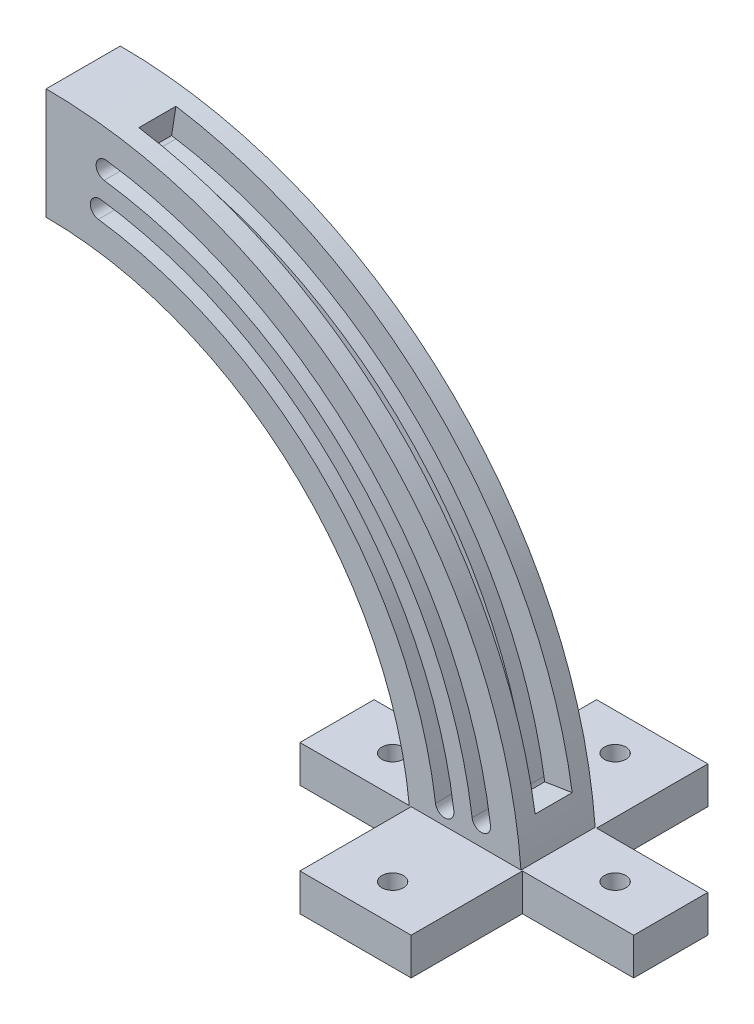
from build123d import *

# Parameters (mm, degrees)
BOSS_EXTRUDE1_DEPTH = 12.7
CUT_EXTRUDE1_DEPTH  = 6.35
CUT_EXTRUDE2_DEPTH  = 233.052537155
SKETCH5_R           = 3.675
BOSS_EXTRUDE2_DEPTH = 12.7


with BuildPart() as part:
    # Sketch1 → Boss-Extrude1 (new, symmetric)
    with BuildSketch(Plane.XY):
        with BuildLine():
            Line((0, 163.1), (0, 125))
            ThreePointArc((0, 125), (88.388347648, 88.388347648), (125, 0))
            Line((125, 0), (163.1, 0))
            ThreePointArc((163.1, 0), (115.329116012, 115.329116012), (0, 163.1))
        make_face()
    extrude(amount=BOSS_EXTRUDE1_DEPTH, both=True)

    # Sketch3 → Cut-Extrude1 (cut, symmetric)
    with BuildSketch(Plane.XY):
        with BuildLine():
            Line((25.4, 161.110055552), (19.466584917, 123.474904623))
            ThreePointArc((19.466584917, 123.474904623), (88.388347648, 88.388347648), (123.474904623, 19.466584917))
            Line((123.474904623, 19.466584917), (161.110055552, 25.4))
            ThreePointArc((161.110055552, 25.4), (115.329116012, 115.329116012), (25.4, 161.110055552))
        make_face()
    extrude(amount=CUT_EXTRUDE1_DEPTH, both=True, mode=Mode.SUBTRACT)

    # Sketch4 → Cut-Extrude2 (cut, through all)
    with BuildSketch(Plane.XY.offset(12.7)):
        with BuildLine():
            ThreePointArc((18.724684767, 139.626667691), (99.614808513, 99.614808513), (139.626667691, 18.724684767))
            ThreePointArc((139.626667691, 18.724684767), (136.90184543, 15.155849254), (133.333009917, 17.880671515))
            ThreePointArc((133.333009917, 17.880671515), (95.124681201, 95.124681201), (17.880671515, 133.333009917))
            ThreePointArc((17.880671515, 133.333009917), (15.155849254, 136.90184543), (18.724684767, 139.626667691))
        make_face()
        with BuildLine():
            ThreePointArc((20.708615854, 152.170890392), (108.592878802, 108.592878802), (152.170890392, 20.708615854))
            ThreePointArc((152.170890392, 20.708615854), (149.453021799, 17.134481891), (145.878887836, 19.852350483))
            ThreePointArc((145.878887836, 19.852350483), (104.102751491, 104.102751491), (19.852350483, 145.878887836))
            ThreePointArc((19.852350483, 145.878887836), (17.134481891, 149.453021799), (20.708615854, 152.170890392))
        make_face()
    extrude(amount=-CUT_EXTRUDE2_DEPTH, mode=Mode.SUBTRACT)

    # Sketch5 → Boss-Extrude2 (add)
    with BuildSketch(Plane(origin=(0, 0, 0), x_dir=(1, 0, 0), z_dir=(0, 1, 0))):
        Polygon((163.1, -12.7), (201.2, -12.7), (201.2, 12.7), (163.1, 12.7), (163.1, 50.8), (125, 50.8), (125, 12.7), (86.9, 12.7), (86.9, -12.7), (125, -12.7), (125, -50.8), (163.1, -50.8), align=None)
        with Locations(Location((105.95, 0, 0), (0, 0, 270))):
            Circle(SKETCH5_R, mode=Mode.SUBTRACT)
        with Locations(Location((182.15, 0, 0), (0, 0, 270))):
            Circle(SKETCH5_R, mode=Mode.SUBTRACT)
        with Locations(Location((144.05, -38.1, 0), (0, 0, 270))):
            Circle(SKETCH5_R, mode=Mode.SUBTRACT)
        with Locations(Location((144.05, 38.1, 0), (0, 0, 270))):
            Circle(SKETCH5_R, mode=Mode.SUBTRACT)
    extrude(amount=BOSS_EXTRUDE2_DEPTH)


solid = part.part
